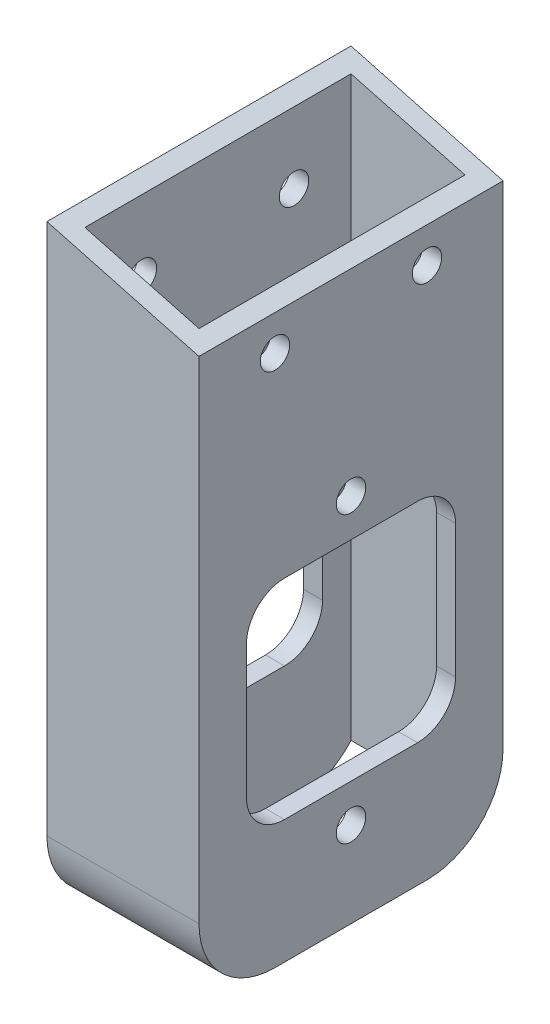
from build123d import *

# Parameters (mm, degrees)
SKETCH1_W                    = 25.4
SKETCH1_H                    = 50.8
SKETCH1_W_2                  = 19.05
SKETCH1_H_2                  = 44.45
BOSS_EXTRUDE1_DEPTH          = 101.6
CUT_EXTRUDE1_DEPTH           = 115.3
CUT_EXTRUDE2_DEPTH           = 108.763073453
SKETCH4_W                    = 34.925
SKETCH4_H                    = 34.925
CUT_EXTRUDE3_DEPTH           = 108.763073453
F_10_0_1935_DIAMETER_HOLE1_D = 4.9149
FILLET1_R                    = 6.35
F_10_0_1935_DIAMETER_HOLE2_D = 4.9149


with BuildPart() as part:
    # Sketch1 → Boss-Extrude1 (new body)
    with BuildSketch(Plane(origin=(0, 0, 0), x_dir=(1, 0, 0), z_dir=(0, 1, 0))):
        Rectangle(SKETCH1_W, SKETCH1_H)
        Rectangle(SKETCH1_W_2, SKETCH1_H_2, mode=Mode.SUBTRACT)
    extrude(amount=BOSS_EXTRUDE1_DEPTH)

    # Sketch2 → Cut-Extrude1 (cut, through all)
    with BuildSketch(Plane.XY.offset(25.4)):
        Polygon((12.7, 101.6), (-12.7, 101.6), (12.7, 94.794090512), align=None)
    extrude(amount=-CUT_EXTRUDE1_DEPTH, mode=Mode.SUBTRACT)

    # Sketch3 → Cut-Extrude2 (cut, through all)
    with BuildSketch(Plane.ZY.offset(12.7)):
        with BuildLine():
            Line((-25.4, 12.7), (-25.4, 0))
            Line((-25.4, 0), (-12.7, 0))
            ThreePointArc((-12.7, 0), (-21.680256121, 3.719743879), (-25.4, 12.7))
        make_face()
        with BuildLine():
            ThreePointArc((25.4, 12.7), (21.680256121, 3.719743879), (12.7, 0))
            Line((12.7, 0), (25.4, 0))
            Line((25.4, 0), (25.4, 12.7))
        make_face()
    extrude(amount=-CUT_EXTRUDE2_DEPTH, mode=Mode.SUBTRACT)

    # Sketch4 → Cut-Extrude3 (cut, through all)
    with BuildSketch(Plane.ZY.offset(12.7)):
        with Locations((0, 38.1)):
            Rectangle(SKETCH4_W, SKETCH4_H)
    extrude(amount=-CUT_EXTRUDE3_DEPTH, mode=Mode.SUBTRACT)

    # #10 (0.1935) Diameter Hole1 (through all)
    with Locations(Plane.ZY.offset(12.7)):
        with Locations((0, 61.9125), (0, 14.2875)):
            Hole(F_10_0_1935_DIAMETER_HOLE1_D / 2)

    # Fillet1
    fillet1_edges = [part.edges().sort_by_distance(p)[0] for p in [
        (-11.1125, 20.6375, -17.4625),
        (-11.1125, 55.5625, -17.4625),
        (-11.1125, 55.5625, 17.4625),
        (-11.1125, 20.6375, 17.4625),
        (11.1125, 20.6375, -17.4625),
        (11.1125, 55.5625, -17.4625),
        (11.1125, 55.5625, 17.4625),
        (11.1125, 20.6375, 17.4625),
    ]]
    fillet(fillet1_edges, radius=FILLET1_R)

    # #10 (0.1935) Diameter Hole2 (through all)
    with Locations(Plane.ZY.offset(12.7)):
        with Locations((-12.7, 88.9), (12.7, 88.9)):
            Hole(F_10_0_1935_DIAMETER_HOLE2_D / 2)


solid = part.part
